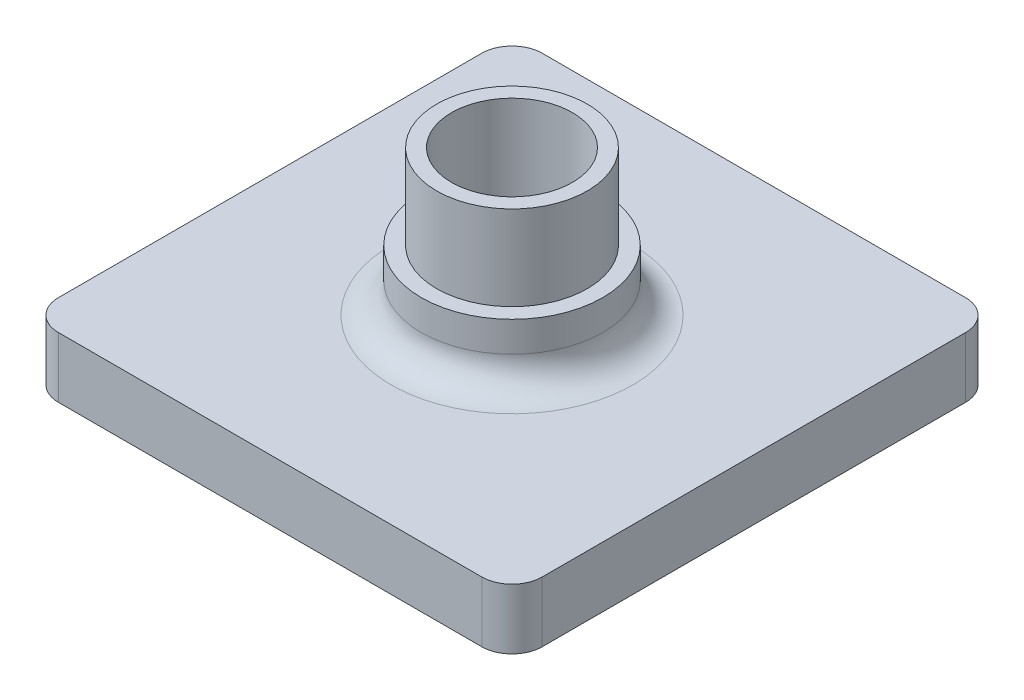
from build123d import *

# Parameters (mm, degrees)
SKETCH1_W           = 40
SKETCH1_H           = 40
BOSS_EXTRUDE1_DEPTH = 5
SKETCH2_R           = 7.5
BOSS_EXTRUDE2_DEPTH = 5
SKETCH4_R           = 6.225
BOSS_EXTRUDE3_DEPTH = 7
FILLET1_R           = 2.5
SKETCH5_R           = 5
CUT_EXTRUDE1_DEPTH  = 17


with BuildPart() as part:
    # Sketch1 → Boss-Extrude1 (new body)
    with BuildSketch(Plane(origin=(0, 0, 0), x_dir=(1, 0, 0), z_dir=(0, 1, 0))):
        Rectangle(SKETCH1_W, SKETCH1_H)
    extrude(amount=BOSS_EXTRUDE1_DEPTH)

    # Sketch2 → Boss-Extrude2 (add)
    with BuildSketch(Plane(origin=(0, 5, 0), x_dir=(1, 0, 0), z_dir=(0, 1, 0))):
        with Locations(Location((0, 0, 0), (0, 0, 270))):
            Circle(SKETCH2_R)
    extrude(amount=BOSS_EXTRUDE2_DEPTH)

    # Sketch4 → Boss-Extrude3 (add)
    with BuildSketch(Plane(origin=(0, 10, 0), x_dir=(1, 0, 0), z_dir=(0, 1, 0))):
        with Locations(Location((0, 0, 0), (0, 0, 270))):
            Circle(SKETCH4_R)
    extrude(amount=BOSS_EXTRUDE3_DEPTH)

    # Fillet1
    fillet1_edges = [part.edges().sort_by_distance(p)[0] for p in [
        (0, 5, -7.5),
        (20, 2.5, 20),
        (-20, 2.5, 20),
        (-20, 2.5, -20),
        (20, 2.5, -20),
    ]]
    fillet(fillet1_edges, radius=FILLET1_R)

    # Sketch5 → Cut-Extrude1 (cut)
    with BuildSketch(Plane(origin=(0, 17, 0), x_dir=(1, 0, 0), z_dir=(0, 1, 0))):
        with Locations(Location((0, 0, 0), (0, 0, 270))):
            Circle(SKETCH5_R)
    extrude(amount=-CUT_EXTRUDE1_DEPTH, mode=Mode.SUBTRACT)


solid = part.part
